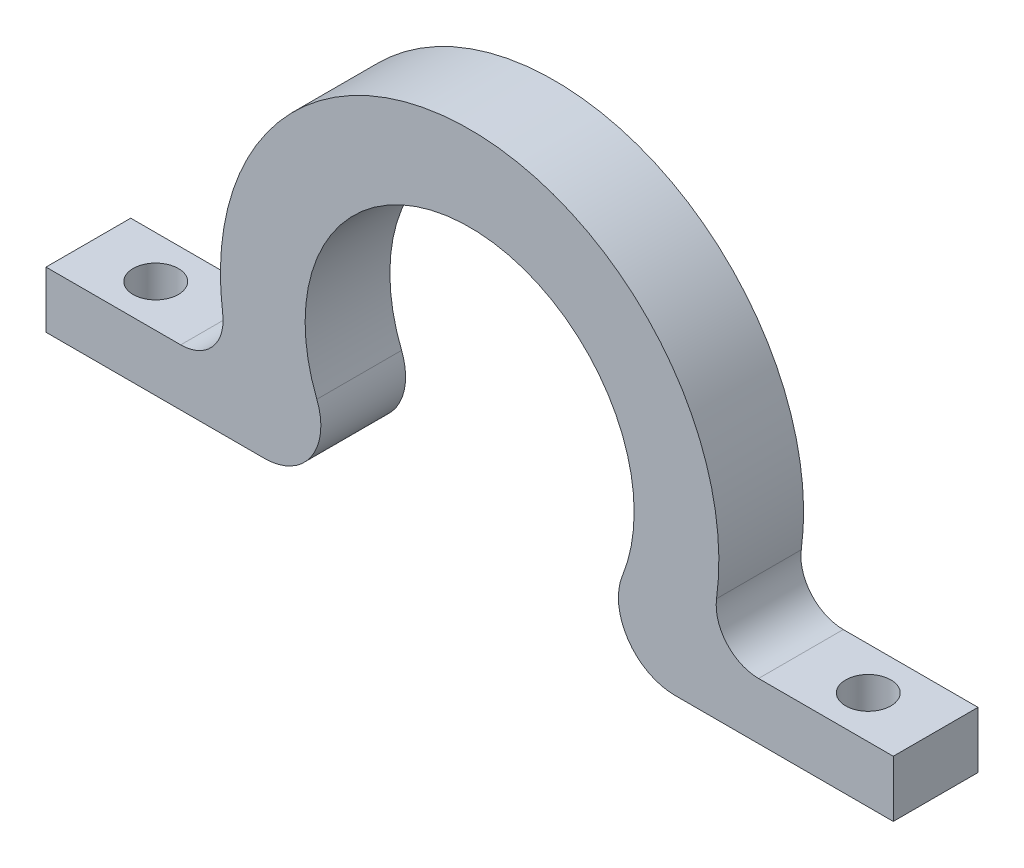
from build123d import *

# Parameters (mm, degrees)
BOSS_EXTRUDE1_DEPTH = 6
SKETCH2_R           = 1.6
CUT_EXTRUDE1_DEPTH  = 39.547405879


with BuildPart() as part:
    # Sketch1 → Boss-Extrude1 (new body)
    with BuildSketch(Plane.XY):
        with BuildLine():
            Line((-14.535559845, -9.8), (-30, -9.8))
            Line((-30, -9.8), (-30, -5.8))
            Line((-30, -5.8), (-20.459288844, -5.8))
            ThreePointArc((-20.459288844, -5.8), (-18.198720444, -4.772265324), (-17.486995065, -2.393220339))
            ThreePointArc((-17.486995065, -2.393220339), (0, 17.65), (17.486995065, -2.393220339))
            ThreePointArc((17.486995065, -2.393220339), (18.198720444, -4.772265324), (20.459288844, -5.8))
            Line((20.459288844, -5.8), (30, -5.8))
            Line((30, -5.8), (30, -9.8))
            Line((30, -9.8), (14.535559845, -9.8))
            ThreePointArc((14.535559845, -9.8), (11.224237416, -8.043912603), (10.820400779, -4.317571885))
            ThreePointArc((10.820400779, -4.317571885), (0, 11.65), (-10.820400779, -4.317571885))
            ThreePointArc((-10.820400779, -4.317571885), (-11.224237416, -8.043912603), (-14.535559845, -9.8))
        make_face()
    extrude(amount=BOSS_EXTRUDE1_DEPTH)

    # Sketch2 → Cut-Extrude1 (cut, through all)
    with BuildSketch(Plane(origin=(0, -5.8, 0), x_dir=(1, 0, 0), z_dir=(0, 1, 0))):
        with Locations(Location((-25.229644422, -3, 0), (0, 0, 270))):
            Circle(SKETCH2_R)
        with Locations(Location((25.229644422, -3, 0), (0, 0, 90))):
            Circle(SKETCH2_R)
    extrude(amount=-CUT_EXTRUDE1_DEPTH, mode=Mode.SUBTRACT)


solid = part.part
